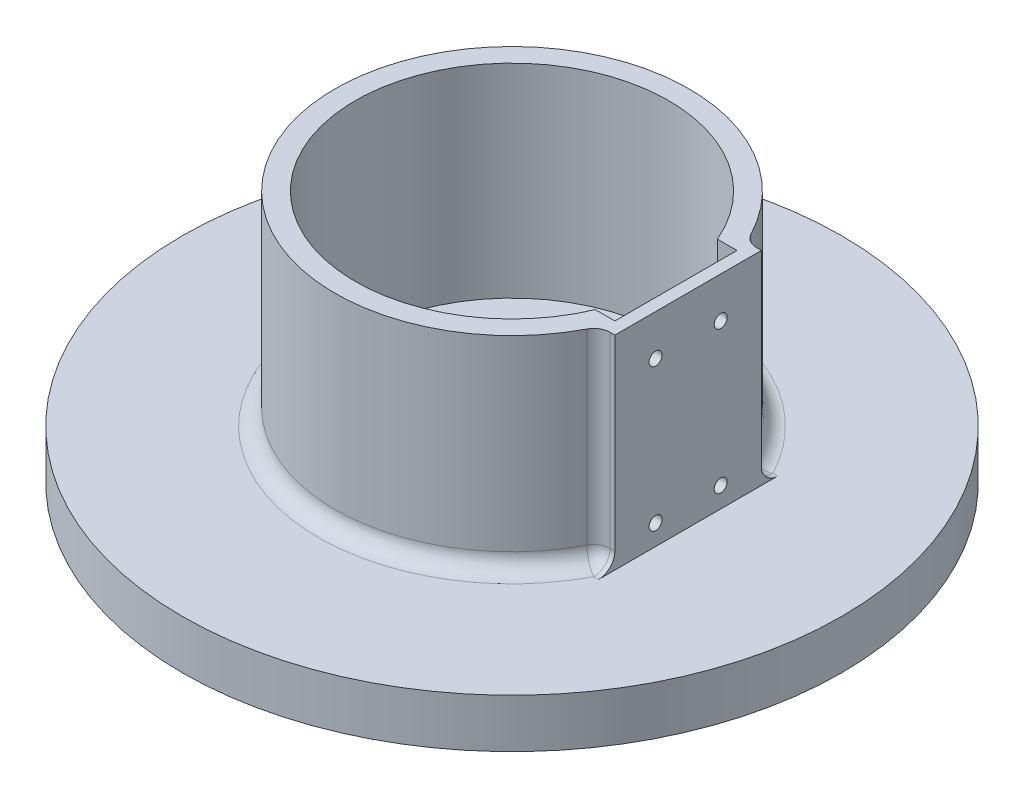
from build123d import *

# Parameters (mm, degrees)
SKETCH1_R           = 81
BOSS_EXTRUDE1_DEPTH = 12
SKETCH2_R           = 76
CUT_EXTRUDE1_DEPTH  = 7
SKETCH3_R           = 32
CUT_EXTRUDE2_DEPTH  = 235.410963907
BOSS_EXTRUDE2_DEPTH = 50
SKETCH5_R           = 1.6
CUT_EXTRUDE3_DEPTH  = 6
FILLET1_R           = 4
FILLET2_R           = 2


with BuildPart() as part:
    # Sketch1 → Boss-Extrude1 (new body)
    with BuildSketch(Plane(origin=(0, 0, 0), x_dir=(1, 0, 0), z_dir=(0, 1, 0))):
        with Locations(Location((105.5, 60.5, 0), (0, 0, 270))):
            Circle(SKETCH1_R)
    extrude(amount=BOSS_EXTRUDE1_DEPTH)

    # Sketch2 → Cut-Extrude1 (cut)
    with BuildSketch(Plane.XZ):
        with Locations(Location((105.5, -60.5, 0), (0, 0, 270))):
            Circle(SKETCH2_R)
    extrude(amount=-CUT_EXTRUDE1_DEPTH, mode=Mode.SUBTRACT)

    # Sketch3 → Cut-Extrude2 (cut, through all)
    with BuildSketch(Plane(origin=(0, 12, 0), x_dir=(1, 0, 0), z_dir=(0, 1, 0))):
        with Locations(Location((105.5, 60.5, 0), (0, 0, 270))):
            Circle(SKETCH3_R)
    extrude(amount=-CUT_EXTRUDE2_DEPTH, mode=Mode.SUBTRACT)

    # Sketch4 → Boss-Extrude2 (add)
    with BuildSketch(Plane(origin=(0, 12, 0), x_dir=(1, 0, 0), z_dir=(0, 1, 0))):
        with BuildLine():
            ThreePointArc((140.957721303, 45.5), (67, 60.5), (140.957721303, 75.5))
            Line((140.957721303, 75.5), (145.775366264, 75.5))
            Line((145.775366264, 75.5), (146.331972766, 75.5))
            ThreePointArc((146.331972766, 75.5), (145.74451839, 77.011472968), (145.101136347, 78.5))
            ThreePointArc((145.101136347, 78.5), (62, 60.5), (145.101136347, 42.5))
            ThreePointArc((145.101136347, 42.5), (145.74451839, 43.988527032), (146.331972766, 45.5))
            Line((146.331972766, 45.5), (145.775366264, 45.5))
            Line((145.775366264, 45.5), (140.957721303, 45.5))
        make_face()
        with BuildLine():
            Line((146.331972766, 75.5), (145.775366264, 75.5))
            Line((145.775366264, 75.5), (145.775366264, 45.5))
            Line((145.775366264, 45.5), (146.331972766, 45.5))
            ThreePointArc((146.331972766, 45.5), (147.885391427, 50.715900981), (148.775366264, 56.084949069))
            Line((148.775366264, 56.084949069), (148.775366264, 64.915050931))
            ThreePointArc((148.775366264, 64.915050931), (147.885391427, 70.284099019), (146.331972766, 75.5))
        make_face()
        with BuildLine():
            ThreePointArc((145.101136347, 78.5), (145.74451839, 77.011472968), (146.331972766, 75.5))
            Line((146.331972766, 75.5), (148.775366264, 75.5))
            Line((148.775366264, 75.5), (148.775366264, 78.5))
            Line((148.775366264, 78.5), (145.101136347, 78.5))
        make_face()
        with BuildLine():
            Line((148.775366264, 75.5), (146.331972766, 75.5))
            ThreePointArc((146.331972766, 75.5), (147.885391427, 70.284099019), (148.775366264, 64.915050931))
            Line((148.775366264, 64.915050931), (148.775366264, 75.5))
        make_face()
        with BuildLine():
            ThreePointArc((148.775366264, 56.084949069), (147.885391427, 50.715900981), (146.331972766, 45.5))
            Line((146.331972766, 45.5), (148.775366264, 45.5))
            Line((148.775366264, 45.5), (148.775366264, 56.084949069))
        make_face()
        with BuildLine():
            Line((148.775366264, 45.5), (146.331972766, 45.5))
            ThreePointArc((146.331972766, 45.5), (145.74451839, 43.988527032), (145.101136347, 42.5))
            Line((145.101136347, 42.5), (148.775366264, 42.5))
            Line((148.775366264, 42.5), (148.775366264, 45.5))
        make_face()
    extrude(amount=BOSS_EXTRUDE2_DEPTH)

    # Sketch5 → Cut-Extrude3 (cut)
    with BuildSketch(Plane(origin=(148.775366264, 0, 0), x_dir=(0, 0, -1), z_dir=(1, 0, 0))):
        with Locations((52.5, 52)):
            Circle(SKETCH5_R)
        with Locations((68.5, 52)):
            Circle(SKETCH5_R)
        with Locations((68.5, 17)):
            Circle(SKETCH5_R)
        with Locations((52.5, 17)):
            Circle(SKETCH5_R)
    extrude(amount=-CUT_EXTRUDE3_DEPTH, mode=Mode.SUBTRACT)

    # Fillet1
    fillet1_edges = [part.edges().sort_by_distance(p)[0] for p in [
        (146.938251306, 12, -42.5),
        (145.101136347, 37, -42.5),
        (62, 12, -60.5),
        (145.101136347, 37, -78.5),
        (146.938251306, 12, -78.5),
    ]]
    fillet(fillet1_edges, radius=FILLET1_R)

    # Fillet2
    fillet2_edges = [part.edges().sort_by_distance(p)[0] for p in [
        (105.5, 7, 15.5),
    ]]
    fillet(fillet2_edges, radius=FILLET2_R)


solid = part.part
